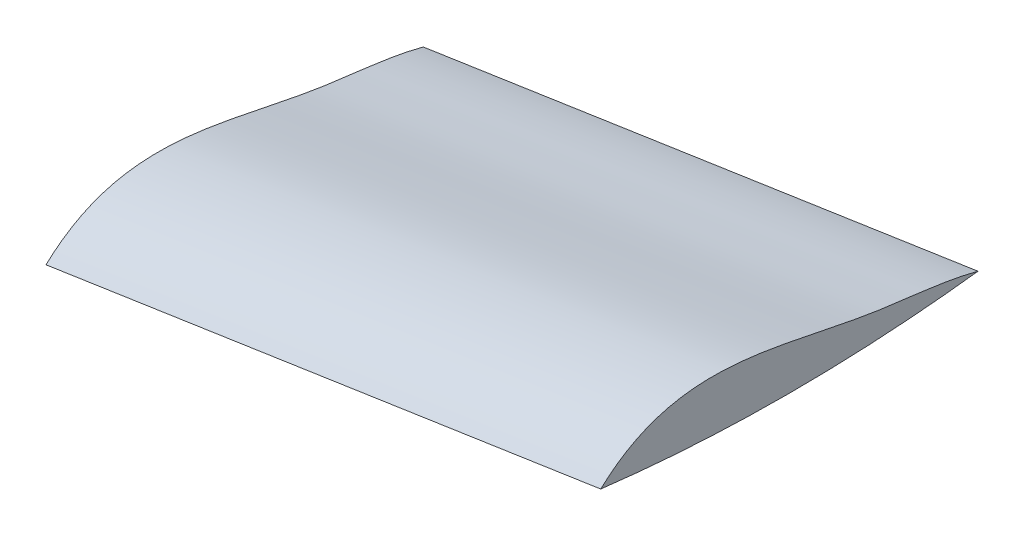
from build123d import *


with BuildPart() as part:
    # Sweep1: sweep along a path in Sketch2
    with BuildLine(Plane(origin=(0, 0, 0), x_dir=(1, 0, 0), z_dir=(0, 1, 0))) as sweep1_path:
        Line((0, 157.491897014), (-635, 45.524264264))
    # Sketch1 → Sweep1 (sweep)
    with BuildSketch(Plane(origin=(0, 0, 0), x_dir=(0, 0, -1), z_dir=(1, 0, 0))):
        with BuildLine():
            add(Edge.make_bspline(
                [(-43.700976459, -3.675096456), (60.093960524, 93.557671037), (246.664616316, 18.259692077), (417.699427231, 8.740783901), (464.299023541, -3.675096456)],
                knots=[0, 0, 0, 0, 0.726776815, 1, 1, 1, 1], degree=3))
            add(Edge.make_bspline(
                [(-43.700976459, -3.675096456), (209.422998909, -34.32642273), (464.299023541, -3.675096456)],
                knots=[0, 0, 0, 1, 1, 1], degree=2))
        make_face()
    sweep(path=sweep1_path.line)


solid = part.part
